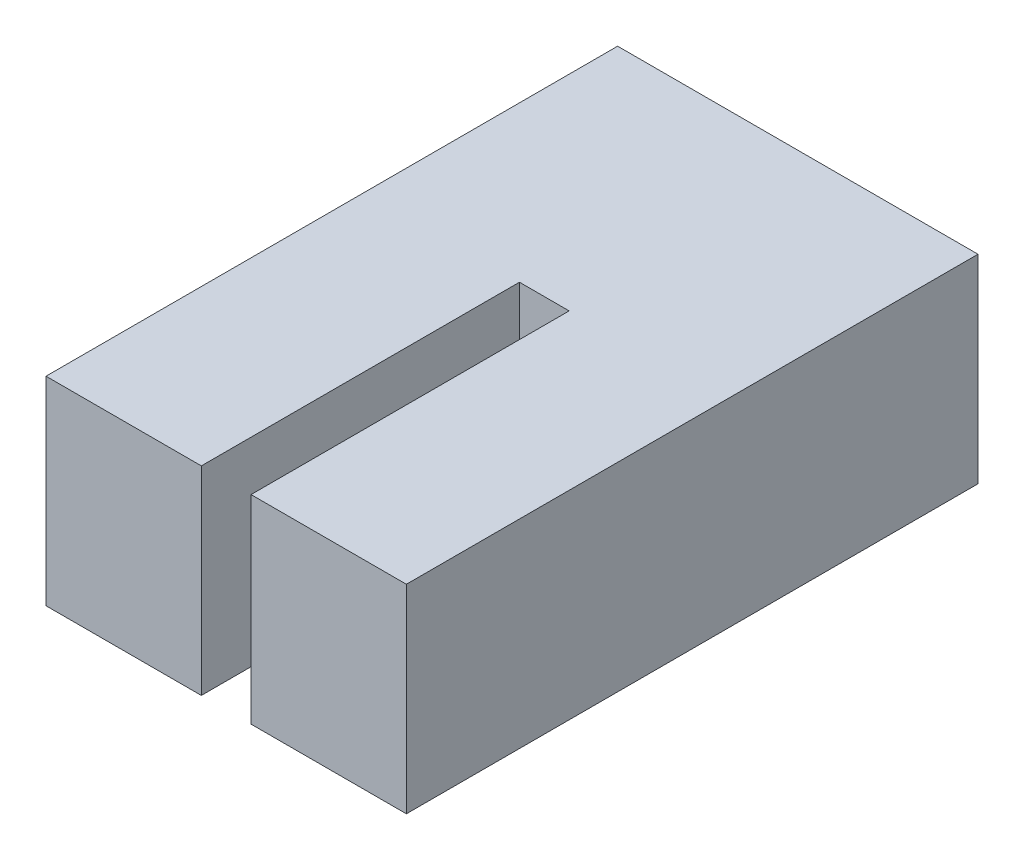
from build123d import *

# Parameters (mm, degrees)
SKETCH1_W               = 14.5
SKETCH1_H               = 8
BOSS_EXTRUDE1_DEPTH     = 23
CUT_EXTRUDE1_DEPTH      = 29.341665442
CUT_EXTRUDE1_DEPTH_BACK = 29.341665442
SKETCH2_W               = 2
SKETCH2_H               = 12.8


with BuildPart() as part:
    # Sketch1 → Boss-Extrude1 (new body)
    with BuildSketch(Plane.XY):
        with Locations((7.25, 4)):
            Rectangle(SKETCH1_W, SKETCH1_H)
    extrude(amount=BOSS_EXTRUDE1_DEPTH)

    # Sketch2 → Cut-Extrude1 (cut, two sides: drawn at the far end of the back side and taken through both)
    with BuildSketch(Plane.XZ.offset(-CUT_EXTRUDE1_DEPTH_BACK)):
        with Locations((7.25, 16.6)):
            Rectangle(SKETCH2_W, SKETCH2_H)
    extrude(amount=CUT_EXTRUDE1_DEPTH + CUT_EXTRUDE1_DEPTH_BACK, mode=Mode.SUBTRACT)


solid = part.part
